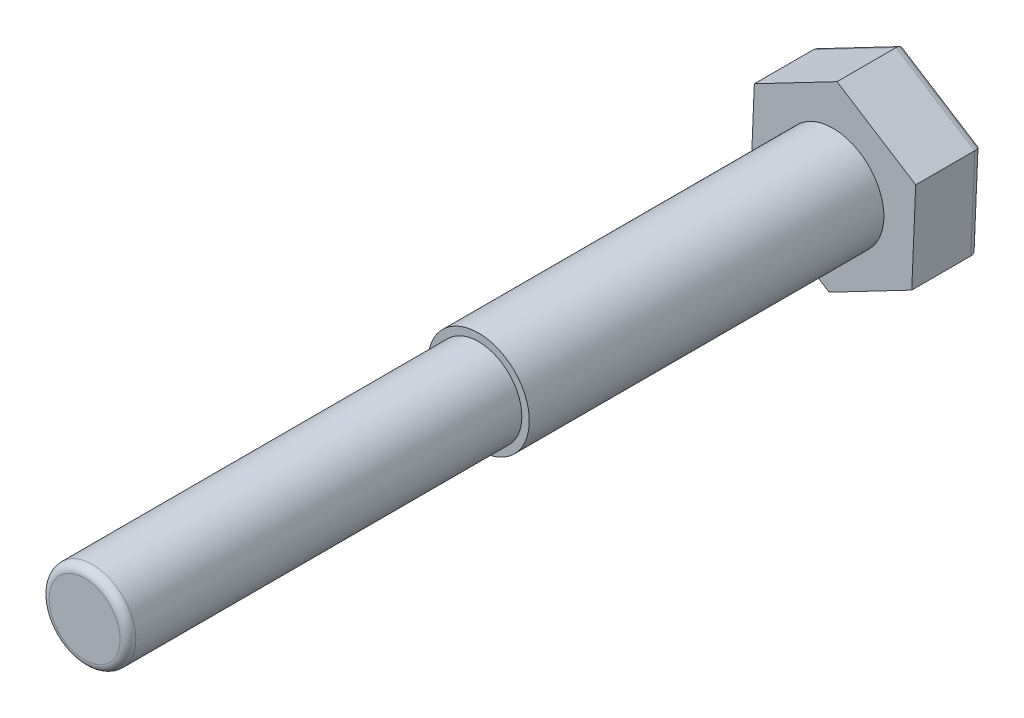
from build123d import *

# Parameters (mm, degrees)
EXTRUDE_305_DEPTH = 17
SKETCH_2_R        = 12.9
EXTRUDE_1_DEPTH   = 90
FILLET_3_R        = 2
SKETCH_3_R        = 11
EXTRUDE_2_DEPTH   = 100
FILLET_4_R        = 2


with BuildPart() as part:
    # 草图1 → Extrude 305 (new body)
    with BuildSketch(Plane.XY):
        Polygon((20.984201837, 10.954296262), (1.005402075, 23.65), (-19.978799762, 12.695703738), (-20.984201837, -10.954296262), (-1.005402075, -23.65), (19.978799762, -12.695703738), align=None)
    extrude(amount=EXTRUDE_305_DEPTH)

    # 草图2 → 凸台-拉伸1 (add)
    with BuildSketch(Plane.XY.offset(17)):
        with Locations(Location((0, 0, 0), (0, 0, 180))):
            Circle(SKETCH_2_R)
    extrude(amount=EXTRUDE_1_DEPTH)

    # 圆角3
    fillet_3_edges = [part.edges().sort_by_distance(p)[0] for p in [
        (9.486698843, -18.172851869, 0),
        (-10.994801956, -17.302148131, 0),
        (-20.4815008, 0.870703738, 0),
        (-9.486698843, 18.172851869, 0),
        (10.994801956, 17.302148131, 0),
        (20.4815008, -0.870703738, 0),
    ]]
    fillet(fillet_3_edges, radius=FILLET_3_R)

    # 草图3 → 凸台-拉伸2 (add)
    with BuildSketch(Plane.XY.offset(107)):
        Circle(SKETCH_3_R)
    extrude(amount=EXTRUDE_2_DEPTH)

    # 圆角4
    fillet_4_edges = [part.edges().sort_by_distance(p)[0] for p in [
        (-11, 0, 207),
    ]]
    fillet(fillet_4_edges, radius=FILLET_4_R)


solid = part.part
